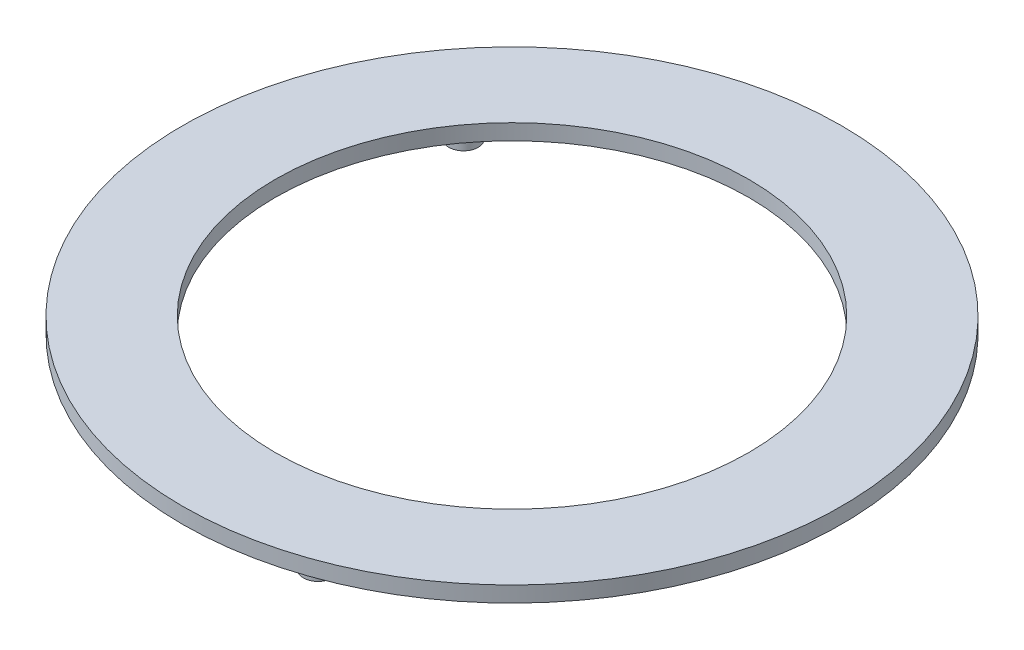
from build123d import *

# Parameters (mm, degrees)
SKETCH1_R           = 31.5
SKETCH1_R_2         = 22.625
BOSS_EXTRUDE1_DEPTH = 1.5
SKETCH2_R           = 1.4
BOSS_EXTRUDE2_DEPTH = 2.8


with BuildPart() as part:
    # Sketch1 → Boss-Extrude1 (new body)
    with BuildSketch(Plane(origin=(0, 0, 0), x_dir=(1, 0, 0), z_dir=(0, 1, 0))):
        with Locations(Location((0, 0, 0), (0, 0, 270))):
            Circle(SKETCH1_R)
        with Locations(Location((0, 0, 0), (0, 0, 270))):
            Circle(SKETCH1_R_2, mode=Mode.SUBTRACT)
    extrude(amount=BOSS_EXTRUDE1_DEPTH)

    # Sketch2 → Boss-Extrude2 (add)
    with BuildSketch(Plane(origin=(0, 0, 0), x_dir=(1, 0, 0), z_dir=(0, 1, 0))):
        with Locations(Location((-21.264622422, 16.637783303, 0), (0, 0, 270))):
            Circle(SKETCH2_R)
        with Locations(Location((9.252342519, 25.365215511, 0), (0, 0, 270))):
            Circle(SKETCH2_R)
        with Locations(Location((26.982884575, -0.961217985, 0), (0, 0, 270))):
            Circle(SKETCH2_R)
        with Locations(Location((7.423997262, -25.959280896, 0), (0, 0, 270))):
            Circle(SKETCH2_R)
        with Locations(Location((-22.394601934, -15.082499932, 0), (0, 0, 270))):
            Circle(SKETCH2_R)
    extrude(amount=-BOSS_EXTRUDE2_DEPTH)


solid = part.part
